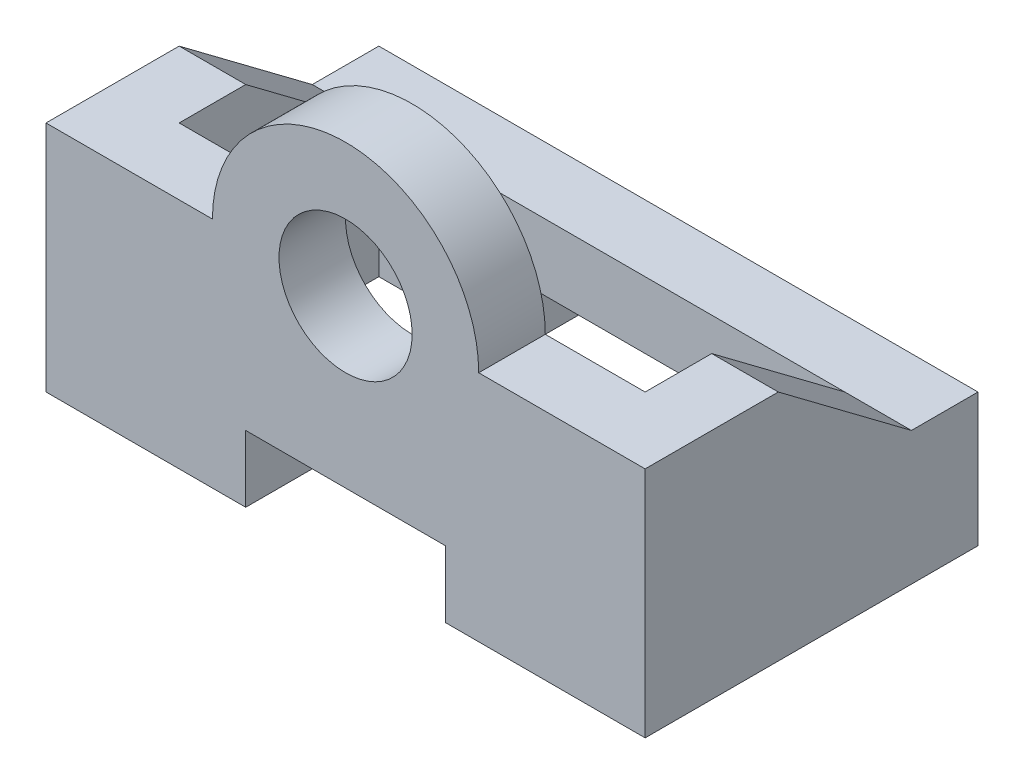
from build123d import *

# Parameters (mm, degrees)
BOSS_EXTRUDE1_DEPTH = 10
BOSS_EXTRUDE2_DEPTH = 5
SKETCH3_R           = 10
BOSS_EXTRUDE3_DEPTH = 10


with BuildPart() as part:
    # Sketch1 → Boss-Extrude1 (new body)
    with BuildSketch(Plane.XY):
        Polygon((-45, -27.5), (-15, -27.5), (-15, -17.5), (15, -17.5), (15, -27.5), (45, -27.5), (45, -7.5), (-45, -7.5), align=None)
    extrude(amount=BOSS_EXTRUDE1_DEPTH)


with BuildPart() as body_2:
    # Sketch2 → Boss-Extrude2 (new, symmetric)
    with BuildSketch(Plane(origin=(0, 0, 0), x_dir=(0, 0, -1), z_dir=(1, 0, 0))):
        Polygon((0, -27.5), (-50, -27.5), (-50, 7.5), (-30, 7.5), (-10, -7.5), (0, -7.5), align=None)
    extrude(amount=BOSS_EXTRUDE2_DEPTH, both=True)


with BuildPart() as body_3:
    # Sketch3 → Boss-Extrude3 (new body)
    with BuildSketch(Plane.XY):
        with BuildLine():
            Line((-45, -27.5), (-15, -27.5))
            Line((-15, -27.5), (-15, -17.5))
            Line((-15, -17.5), (15, -17.5))
            Line((15, -17.5), (15, -27.5))
            Line((15, -27.5), (45, -27.5))
            Line((45, -27.5), (45, 7.5))
            Line((45, 7.5), (20, 7.5))
            ThreePointArc((20, 7.5), (0, 27.5), (-20, 7.5))
            Line((-20, 7.5), (-45, 7.5))
            Line((-45, 7.5), (-45, -27.5))
        make_face()
        with Locations((0, 7.5)):
            Circle(SKETCH3_R, mode=Mode.SUBTRACT)
    extrude(amount=-BOSS_EXTRUDE3_DEPTH)


with BuildPart() as body_3_1:
    # Body-Move/Copy1: moved
    add(body_3.part.moved(Location((0, 0, 50))))


with BuildPart() as body_2_1:
    # Body-Move/Copy2: moved
    add(body_2.part.moved(Location((40, 0, 0))))


with BuildPart() as body_4:
    # Body-Move/Copy3: copy of body 2
    add(body_2_1.part.moved(Location((-80, 0, 0))))


with BuildPart() as body_2_2:
    add(body_2_1.part)

    # Combine1: union body 3, body 4, part
    add(body_3_1.part)
    add(body_4.part)
    add(part.part)


with BuildPart() as body_2_3:
    # Body-Move/Copy5: moved
    add(body_2_2.part.moved(Location((0, 0, -25))))


solid = body_2_3.part
